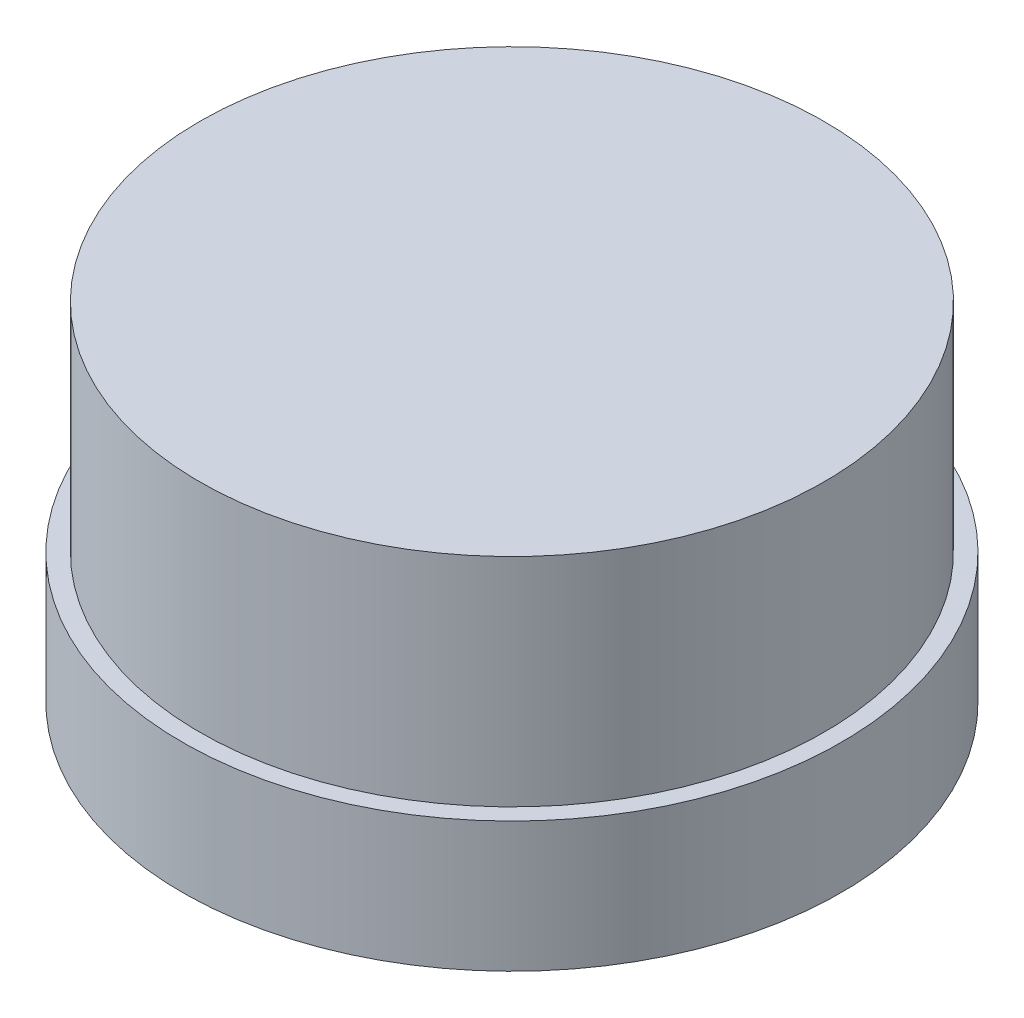
from build123d import *


with BuildPart() as part:
    # Sketch1 → Revolve1 (revolve)
    with BuildSketch(Plane.XY, mode=Mode.PRIVATE) as revolve1_sk:
        Polygon((0, 0), (38, 0), (38, 15), (36, 15), (36, 40), (0, 40), align=None)
    revolve(revolve1_sk.sketch.rotate(Axis((0, 40, 0), (0, -1, 0)), 180), axis=Axis((0, 40, 0), (0, -1, 0)))


solid = part.part
